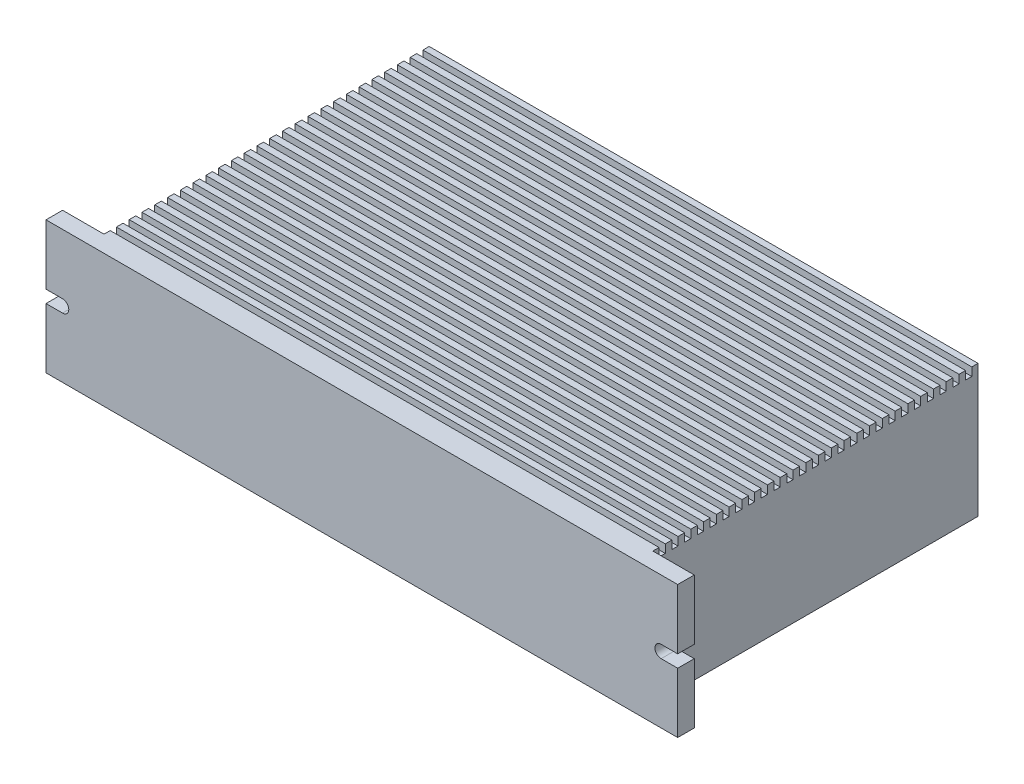
from build123d import *

# Parameters (mm, degrees)
SKETCH_1_W               = 265
SKETCH_1_H               = 165
EXTRUDE_1_DEPTH          = 64
EXTRUDE_2_DEPTH          = 8
CUT_EXTRUDE_1_DEPTH      = 185.820182881
CUT_EXTRUDE_1_DEPTH_BACK = 185.820182881
SKETCH_3_W               = 3
SKETCH_3_H               = 4
SKETCH_4_W               = 141
SKETCH_4_H               = 44
CUT_EXTRUDE_2_DEPTH      = 120


with BuildPart() as part:
    # 草图1 → 凸台-拉伸1 (new body)
    with BuildSketch(Plane(origin=(0, 0, 0), x_dir=(1, 0, 0), z_dir=(0, 1, 0))):
        Rectangle(SKETCH_1_W, SKETCH_1_H)
    extrude(amount=EXTRUDE_1_DEPTH)

    # 草图2 → 凸台-拉伸2 (add)
    with BuildSketch(Plane.XY.offset(82.5)):
        with BuildLine():
            Line((-132.5, 64), (-152.5, 64))
            Line((-152.5, 64), (-152.5, 35))
            Line((-152.5, 35), (-144.5, 35))
            ThreePointArc((-144.5, 35), (-141.5, 32), (-144.5, 29))
            Line((-144.5, 29), (-152.5, 29))
            Line((-152.5, 29), (-152.5, 0))
            Line((-152.5, 0), (-132.5, 0))
            Line((-132.5, 0), (-132.5, 64))
        make_face()
        with BuildLine():
            Line((152.5, 64), (132.5, 64))
            Line((132.5, 64), (132.5, 0))
            Line((132.5, 0), (152.5, 0))
            Line((152.5, 0), (152.5, 29))
            Line((152.5, 29), (144.5, 29))
            ThreePointArc((144.5, 29), (141.5, 32), (144.5, 35))
            Line((144.5, 35), (152.5, 35))
            Line((152.5, 35), (152.5, 64))
        make_face()
    extrude(amount=-EXTRUDE_2_DEPTH)

    # 草图3 → 切除-拉伸1 (cut, two sides: drawn at the far end of the back side and taken through both)
    with BuildSketch(Plane(origin=(0, 0, 0), x_dir=(0, 0, -1), z_dir=(1, 0, 0)).offset(-CUT_EXTRUDE_1_DEPTH_BACK)):
        with Locations((-70, 62)):
            Rectangle(SKETCH_3_W, SKETCH_3_H)
        with Locations((-63.833333333, 62)):
            Rectangle(SKETCH_3_W, SKETCH_3_H)
        with Locations((-57.666666667, 62)):
            Rectangle(SKETCH_3_W, SKETCH_3_H)
        with Locations((-51.5, 62)):
            Rectangle(SKETCH_3_W, SKETCH_3_H)
        with Locations((-45.333333333, 62)):
            Rectangle(SKETCH_3_W, SKETCH_3_H)
        with Locations((-39.166666667, 62)):
            Rectangle(SKETCH_3_W, SKETCH_3_H)
        with Locations((-33, 62)):
            Rectangle(SKETCH_3_W, SKETCH_3_H)
        with Locations((-26.833333333, 62)):
            Rectangle(SKETCH_3_W, SKETCH_3_H)
        with Locations((-20.666666667, 62)):
            Rectangle(SKETCH_3_W, SKETCH_3_H)
        with Locations((-14.5, 62)):
            Rectangle(SKETCH_3_W, SKETCH_3_H)
        with Locations((-8.333333333, 62)):
            Rectangle(SKETCH_3_W, SKETCH_3_H)
        with Locations((-2.166666667, 62)):
            Rectangle(SKETCH_3_W, SKETCH_3_H)
        with Locations((4, 62)):
            Rectangle(SKETCH_3_W, SKETCH_3_H)
        with Locations((10.166666667, 62)):
            Rectangle(SKETCH_3_W, SKETCH_3_H)
        with Locations((16.333333333, 62)):
            Rectangle(SKETCH_3_W, SKETCH_3_H)
        with Locations((22.5, 62)):
            Rectangle(SKETCH_3_W, SKETCH_3_H)
        with Locations((28.666666667, 62)):
            Rectangle(SKETCH_3_W, SKETCH_3_H)
        with Locations((34.833333333, 62)):
            Rectangle(SKETCH_3_W, SKETCH_3_H)
        with Locations((41, 62)):
            Rectangle(SKETCH_3_W, SKETCH_3_H)
        with Locations((47.166666667, 62)):
            Rectangle(SKETCH_3_W, SKETCH_3_H)
        with Locations((53.333333333, 62)):
            Rectangle(SKETCH_3_W, SKETCH_3_H)
        with Locations((59.5, 62)):
            Rectangle(SKETCH_3_W, SKETCH_3_H)
        with Locations((65.666666667, 62)):
            Rectangle(SKETCH_3_W, SKETCH_3_H)
        with Locations((71.833333333, 62)):
            Rectangle(SKETCH_3_W, SKETCH_3_H)
        with Locations((78, 62)):
            Rectangle(SKETCH_3_W, SKETCH_3_H)
    extrude(amount=CUT_EXTRUDE_1_DEPTH + CUT_EXTRUDE_1_DEPTH_BACK, mode=Mode.SUBTRACT)

    # 草图4 → 切除-拉伸2 (cut, symmetric)
    with BuildSketch(Plane(origin=(0, 0, 0), x_dir=(0, 0, -1), z_dir=(1, 0, 0))):
        with Locations((4, 30)):
            Rectangle(SKETCH_4_W, SKETCH_4_H)
    extrude(amount=CUT_EXTRUDE_2_DEPTH, both=True, mode=Mode.SUBTRACT)


solid = part.part
